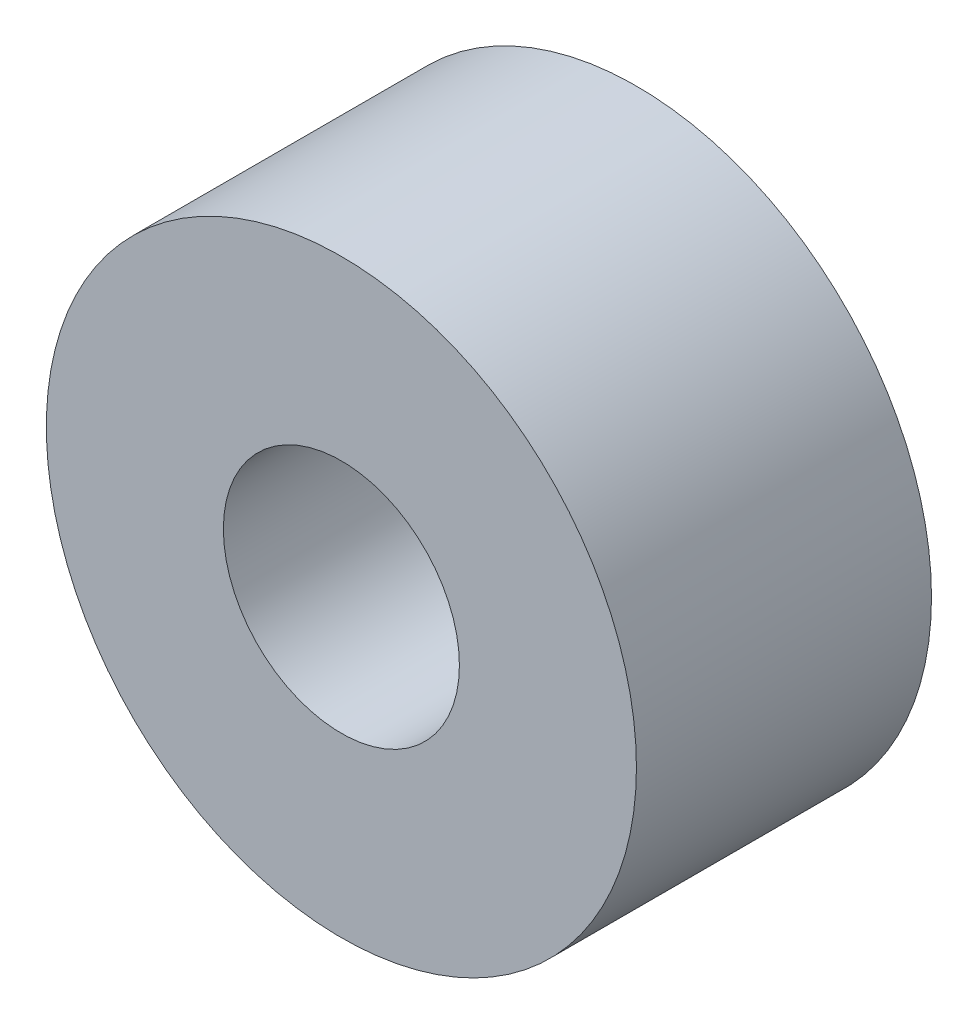
from build123d import *

# Parameters (mm, degrees)
EXTRUDE1_DEPTH      = 2
EXTRUDE1_DEPTH_BACK = 2
SKETCH1_R           = 4
SKETCH1_R_2         = 1.6


with BuildPart() as part:
    # Sketch1 → Extrude1 (new, two sides: drawn at the far end of the back side and taken through both)
    with BuildSketch(Plane.XY.offset(-EXTRUDE1_DEPTH_BACK)):
        Circle(SKETCH1_R)
        Circle(SKETCH1_R_2, mode=Mode.SUBTRACT)
    extrude(amount=EXTRUDE1_DEPTH + EXTRUDE1_DEPTH_BACK)


solid = part.part
